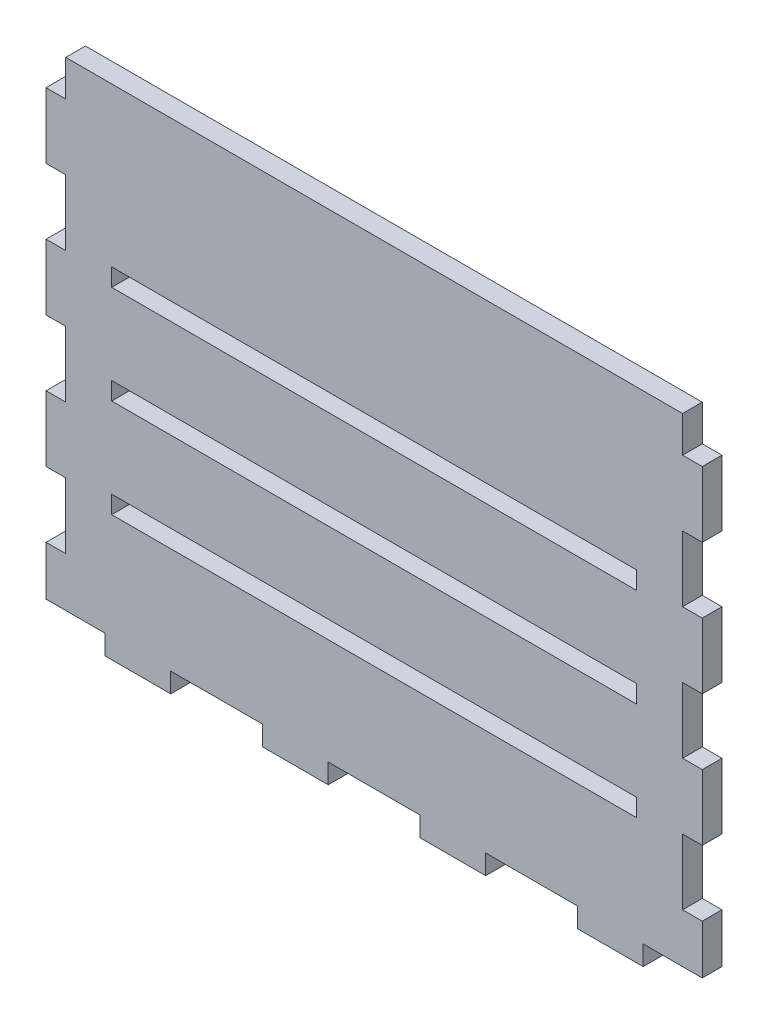
from build123d import *

# Parameters (mm, degrees)
EXTRUDE_1_DEPTH     = 3
SKETCH_2_W          = 80
SKETCH_2_H          = 2.7
CUT_EXTRUDE_1_DEPTH = 3
SKETCH_3_W          = 100
SKETCH_3_H          = 8
EXTRUDE_3_DEPTH     = 3
SKETCH_4_W          = 3
SKETCH_4_H          = 5.5
CUT_EXTRUDE_2_DEPTH = 3


with BuildPart() as part:
    # 草圖1 → 填料-伸長1 (new body)
    with BuildSketch(Plane.XY):
        Polygon((-61.919288793, 23.718072979), (-52.919288793, 23.718072979), (-52.919288793, 26.718072979), (-42.919288793, 26.718072979), (-42.919288793, 23.718072979), (-28.919288793, 23.718072979), (-28.919288793, 26.718072979), (-18.919288793, 26.718072979), (-18.919288793, 23.718072979), (-4.919288793, 23.718072979), (-4.919288793, 26.718072979), (5.080711207, 26.718072979), (5.080711207, 23.718072979), (19.080711207, 23.718072979), (19.080711207, 26.718072979), (29.080711207, 26.718072979), (29.080711207, 23.718072979), (38.080711207, 23.718072979), (38.080711207, 16.218072979), (35.080711207, 16.218072979), (35.080711207, 6.218072979), (38.080711207, 6.218072979), (38.080711207, -3.781927021), (35.080711207, -3.781927021), (35.080711207, -13.781927021), (38.080711207, -13.781927021), (38.080711207, -23.781927021), (35.080711207, -23.781927021), (35.080711207, -33.781927021), (38.080711207, -33.781927021), (38.080711207, -41.281927021), (29.080711207, -41.281927021), (29.080711207, -44.281927021), (19.080711207, -44.281927021), (19.080711207, -41.281927021), (5.080711207, -41.281927021), (5.080711207, -44.281927021), (-4.919288793, -44.281927021), (-4.919288793, -41.281927021), (-18.919288793, -41.281927021), (-18.919288793, -44.281927021), (-28.919288793, -44.281927021), (-28.919288793, -41.281927021), (-42.919288793, -41.281927021), (-42.919288793, -44.281927021), (-52.919288793, -44.281927021), (-52.919288793, -41.281927021), (-61.919288793, -41.281927021), (-61.919288793, -33.781927021), (-58.919288793, -33.781927021), (-58.919288793, -23.781927021), (-61.919288793, -23.781927021), (-61.919288793, -13.781927021), (-58.919288793, -13.781927021), (-58.919288793, -3.781927021), (-61.919288793, -3.781927021), (-61.919288793, 6.218072979), (-58.919288793, 6.218072979), (-58.919288793, 16.218072979), (-61.919288793, 16.218072979), align=None)
    extrude(amount=EXTRUDE_1_DEPTH)

    # 草圖2 → 除料-伸長1 (cut)
    with BuildSketch(Plane(origin=(0, 0, 0), x_dir=(-1, 0, 0), z_dir=(0, 0, -1))):
        with Locations((11.919288793, -8.781927021)):
            Rectangle(SKETCH_2_W, SKETCH_2_H)
        with Locations((11.919288793, 6.218072979)):
            Rectangle(SKETCH_2_W, SKETCH_2_H)
        with Locations((11.919288793, -23.781927021)):
            Rectangle(SKETCH_2_W, SKETCH_2_H)
    extrude(amount=-CUT_EXTRUDE_1_DEPTH, mode=Mode.SUBTRACT)

    # 草圖3 → 填料-伸長3 (add)
    with BuildSketch(Plane.XY.offset(3)):
        with Locations((-11.919288793, 27.718072979)):
            Rectangle(SKETCH_3_W, SKETCH_3_H)
    extrude(amount=-EXTRUDE_3_DEPTH)

    # 草圖4 → 除料-伸長2 (cut)
    with BuildSketch(Plane.XY.offset(3)):
        with Locations((36.580711207, 28.968072979)):
            Rectangle(SKETCH_4_W, SKETCH_4_H)
        with Locations((-60.419288793, 28.968072979)):
            Rectangle(SKETCH_4_W, SKETCH_4_H)
    extrude(amount=-CUT_EXTRUDE_2_DEPTH, mode=Mode.SUBTRACT)


solid = part.part
